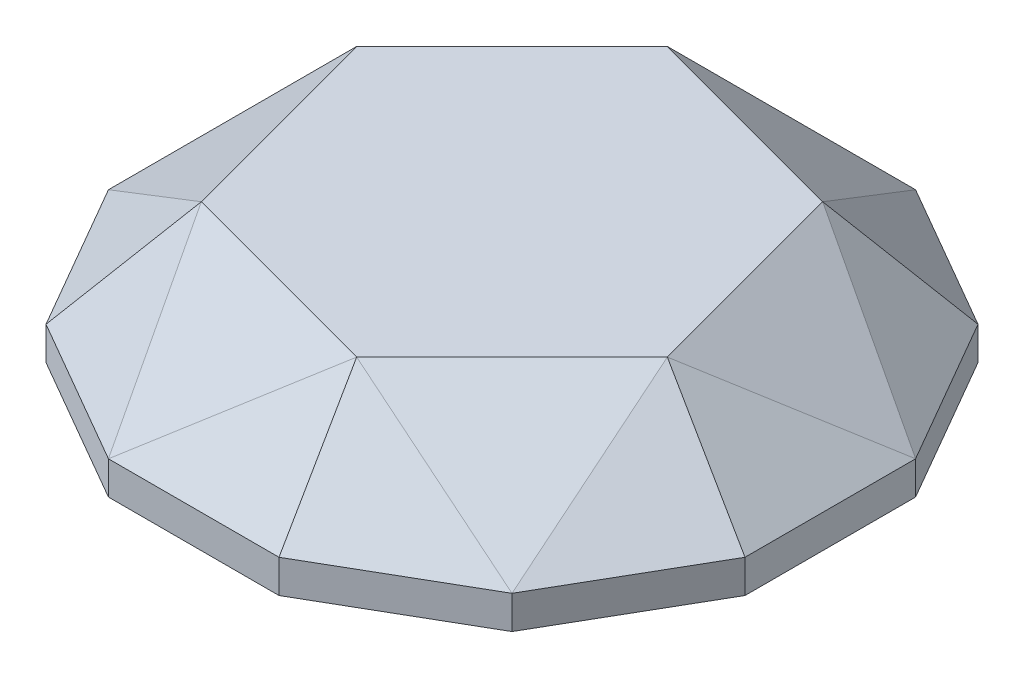
from build123d import *

# Parameters (mm, degrees)
BOSS_EXTRUDE2_DEPTH = 5.08
BOSS_EXTRUDE2_TAPER = 45
CUT_EXTRUDE1_DEPTH  = 28.788825452
CIRPATTERN1_COUNT   = 6
CUT_EXTRUDE2_DEPTH  = 4.572
CUT_EXTRUDE2_DRAFT  = -50
BOSS_EXTRUDE3_DEPTH = 1.5875


with BuildPart() as part:
    # Sketch2 → Boss-Extrude2 (new body)
    with BuildSketch(Plane(origin=(0, 0, 0), x_dir=(1, 0, 0), z_dir=(0, 1, 0))):
        Polygon((-11.156454307, -11.156454307), (-4.083545693, -15.24), (4.083545693, -15.24), (11.156454307, -11.156454307), (15.24, -4.083545693), (15.24, 4.083545693), (11.156454307, 11.156454307), (4.083545693, 15.24), (-4.083545693, 15.24), (-11.156454307, 11.156454307), (-15.24, 4.083545693), (-15.24, -4.083545693), align=None)
    extrude(amount=BOSS_EXTRUDE2_DEPTH, taper=BOSS_EXTRUDE2_TAPER)

    # Sketch3 → Cut-Extrude1 (cut, through all)
    with BuildSketch(Plane(origin=(-1.499582091, 7.605575605, 5.596516554), x_dir=(-0.9876151240341646, -0.12385705516936496, -0.09631093740460966), z_dir=(0.15684209814252395, -0.795471246716067, -0.5853426790336042))):
        Polygon((-4.296360621, -5.154612088), (6.000002448, -3.004781355), (2.5651928, -12.285691151), align=None)
    cut_extrude1 = extrude(amount=-CUT_EXTRUDE1_DEPTH, mode=Mode.SUBTRACT)

    # CirPattern1: Cut-Extrude1 ×6 about axis
    cirpattern1_axis = Axis((0, 0, 0), (0, 1, 0))
    for i in range(1, CIRPATTERN1_COUNT):
        add(cut_extrude1.rotate(cirpattern1_axis, i * 360 / CIRPATTERN1_COUNT), mode=Mode.SUBTRACT)


with BuildPart() as cut_extrude2_tool:
    # Sketch5 → Cut-Extrude2 (with draft: the straight prism first)
    with BuildSketch(Plane.XZ):
        Polygon((13.933401039, -3.877261622), (14.005310072, 3.608893457), (10.324507581, 10.12804845), (3.877261622, 13.933401039), (-3.608893457, 14.005310072), (-10.12804845, 10.324507581), (-13.933401039, 3.877261622), (-14.005310072, -3.608893457), (-10.324507581, -10.12804845), (-3.877261622, -13.933401039), (3.608893457, -14.005310072), (10.12804845, -10.324507581), align=None)
    extrude(amount=-CUT_EXTRUDE2_DEPTH)
    # Cut-Extrude2: the draft: its side faces are tilted about the plane it starts from
    cut_extrude2_sides = [cut_extrude2_tool.faces().sort_by_distance(p)[0] for p in [
        (13.969355555, 2.286, -0.134184083),
        (12.164908827, 2.286, 6.868470953),
        (7.100884602, 2.286, 12.030724744),
        (0.134184083, 2.286, 13.969355555),
        (-6.868470953, 2.286, 12.164908827),
        (-12.030724744, 2.286, 7.100884602),
        (-13.969355555, 2.286, 0.134184083),
        (-12.164908827, 2.286, -6.868470953),
        (-7.100884602, 2.286, -12.030724744),
        (-0.134184083, 2.286, -13.969355555),
        (6.868470953, 2.286, -12.164908827),
        (12.030724744, 2.286, -7.100884602),
    ]]
    draft(cut_extrude2_sides, Plane.XZ, CUT_EXTRUDE2_DRAFT)


with BuildPart() as part_1:
    add(part.part)

    # Cut-Extrude2: cut by cut_extrude2_tool
    add(cut_extrude2_tool.part, mode=Mode.SUBTRACT)

    # Sketch8 → Boss-Extrude3 (add)
    with BuildSketch(Plane.XZ):
        Polygon((-15.24, -4.083545693), (-11.156454307, -11.156454307), (-4.083545693, -15.24), (4.083545693, -15.24), (11.156454307, -11.156454307), (15.24, -4.083545693), (15.24, 4.083545693), (11.156454307, 11.156454307), (4.083545693, 15.24), (-4.083545693, 15.24), (-11.156454307, 11.156454307), (-15.24, 4.083545693), align=None)
        Polygon((-10.12804845, 10.324507581), (-13.933401039, 3.877261622), (-14.005310072, -3.608893457), (-10.324507581, -10.12804845), (-3.877261622, -13.933401039), (3.608893457, -14.005310072), (10.12804845, -10.324507581), (13.933401039, -3.877261622), (14.005310072, 3.608893457), (10.324507581, 10.12804845), (3.877261622, 13.933401039), (-3.608893457, 14.005310072), align=None, mode=Mode.SUBTRACT)
    extrude(amount=BOSS_EXTRUDE3_DEPTH)


solid = part_1.part
